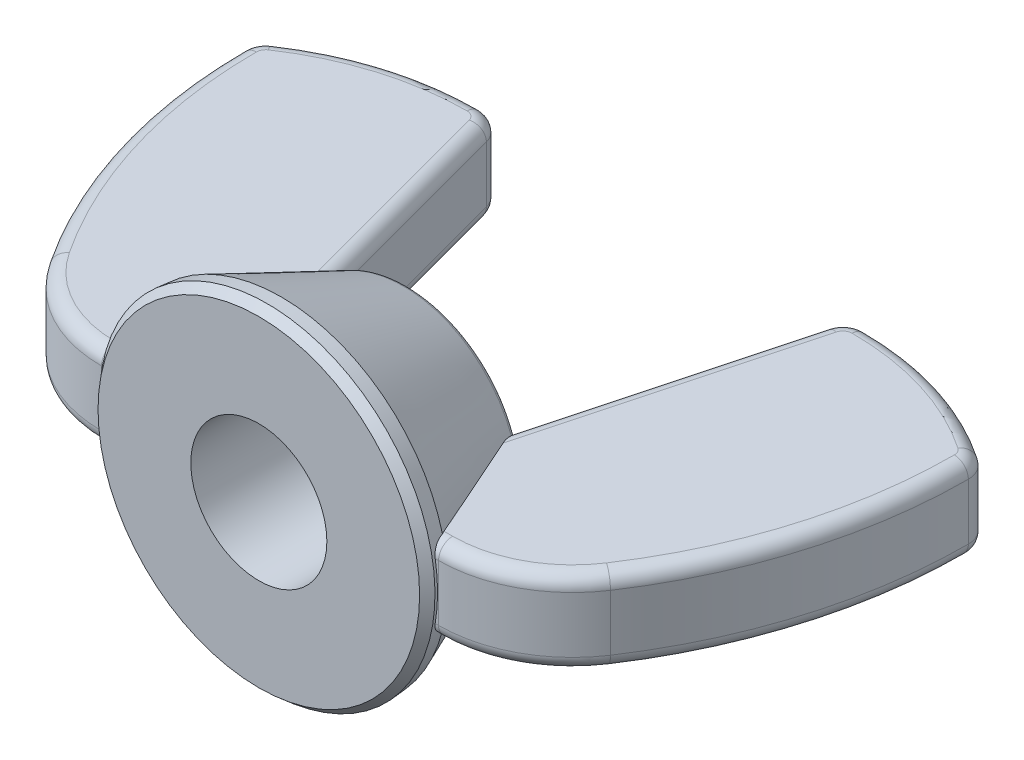
from build123d import *

# Parameters (mm, degrees)
EXTRUDE2_DEPTH     = 1.28984375
SKETCH3_R          = 5.159375
EXTRUDE1_DEPTH     = 0.6858
EXTRUDE1_DRAFT     = -5
SKETCH15_R         = 5.099375275
EXTRUDE3_DEPTH     = 3.8862
EXTRUDE3_TAPER     = 22.89012698
FILLET3_R          = 0.254
SKETCH4_R          = 2.0828
CUT_EXTRUDE1_DEPTH = 18.646438922
CHAMFER1_SIZE      = 0.257175
CHAMFER1_SIZE2     = 0.237388559
FILLET4_R          = 0.429947917


with BuildPart() as part:
    # Sketch13 → Extrude2 (new, symmetric)
    with BuildSketch(Plane(origin=(0, 0, 0), x_dir=(1, 0, 0), z_dir=(0, 1, 0))):
        with BuildLine():
            Line((3.166712045, 0.3429), (5.159375, 0.3429))
            ThreePointArc((5.159375, 0.3429), (7.101768744, 0.832103373), (8.580723973, 2.182993757))
            ThreePointArc((8.580723973, 2.182993757), (10.465874951, 6.208977734), (11.1125, 10.607183874))
            ThreePointArc((11.1125, 10.607183874), (11.028622602, 10.943597741), (10.796626512, 11.201255503))
            ThreePointArc((10.796626512, 11.201255503), (8.457534763, 12.316945036), (5.894454148, 12.7))
            ThreePointArc((5.894454148, 12.7), (5.458227968, 12.551921165), (5.202291154, 12.168884654))
            Line((5.202291154, 12.168884654), (3.166712045, 4.572))
            Line((3.166712045, 4.572), (3.166712045, 0.3429))
        make_face()
    extrude(amount=EXTRUDE2_DEPTH, both=True)

    # Fillet4
    fillet4_edges = [part.edges().sort_by_distance(p)[0] for p in [
        (7.101768744, 1.28984375, -0.832103373),
        (4.163043523, -1.28984375, -0.3429),
        (10.465874951, 1.28984375, -6.208977734),
        (11.028622602, 1.28984375, -10.943597741),
        (8.457534763, 1.28984375, -12.316945036),
        (5.458227968, 1.28984375, -12.551921165),
        (4.1845016, 1.28984375, -8.370442327),
        (4.163043523, 1.28984375, -0.3429),
        (4.1845016, -1.28984375, -8.370442327),
        (5.458227968, -1.28984375, -12.551921165),
        (8.457534763, -1.28984375, -12.316945036),
        (11.028622602, -1.28984375, -10.943597741),
        (10.465874951, -1.28984375, -6.208977734),
        (7.101768744, -1.28984375, -0.832103373),
    ]]
    fillet(fillet4_edges, radius=FILLET4_R)


with BuildPart() as body_2:
    # Sketch3 → Extrude1 (with draft: the straight prism first)
    with BuildSketch(Plane.XY):
        Circle(SKETCH3_R)
    extrude(amount=-EXTRUDE1_DEPTH)
    # Extrude1: the draft: its side faces are tilted about the plane it starts from
    extrude1_sides = [body_2.faces().sort_by_distance(p)[0] for p in [
        (-5.159375, 0, -0.3429),
    ]]
    draft(extrude1_sides, Plane.XY, EXTRUDE1_DRAFT)

    # Sketch15 → Extrude3 (add)
    with BuildSketch(Plane(origin=(0, 0, -0.6858), x_dir=(-1, 0, 0), z_dir=(0, 0, -1))):
        Circle(SKETCH15_R)
    extrude(amount=EXTRUDE3_DEPTH, taper=EXTRUDE3_TAPER)

    # Fillet3
    fillet3_edges = [body_2.edges().sort_by_distance(p)[0] for p in [
        (3.458569214, 0, -4.572),
    ]]
    fillet(fillet3_edges, radius=FILLET3_R)

    # Sketch4 → Cut-Extrude1 (cut, through all)
    with BuildSketch(Plane.XY):
        Circle(SKETCH4_R)
    extrude(amount=-CUT_EXTRUDE1_DEPTH, mode=Mode.SUBTRACT)

    # Chamfer1
    chamfer1_edges = [body_2.edges().sort_by_distance(p)[0] for p in [
        (-5.159375, 0, 0),
    ]]
    chamfer1_side = [body_2.faces().sort_by_distance(p)[0] for p in [
        (-5.129375137, 0, -0.3429),
    ]]
    chamfer(chamfer1_edges, length=CHAMFER1_SIZE, length2=CHAMFER1_SIZE2, reference=chamfer1_side[0])


with BuildPart() as body_3:
    # Mirror6: mirrored copy
    add(part.part.mirror(Plane(origin=(0, 0, 0), x_dir=(0, 0, 1), z_dir=(1, 0, 0))))

    # Combine2: union part, body 2
    add(part.part)
    add(body_2.part)


solid = body_3.part
